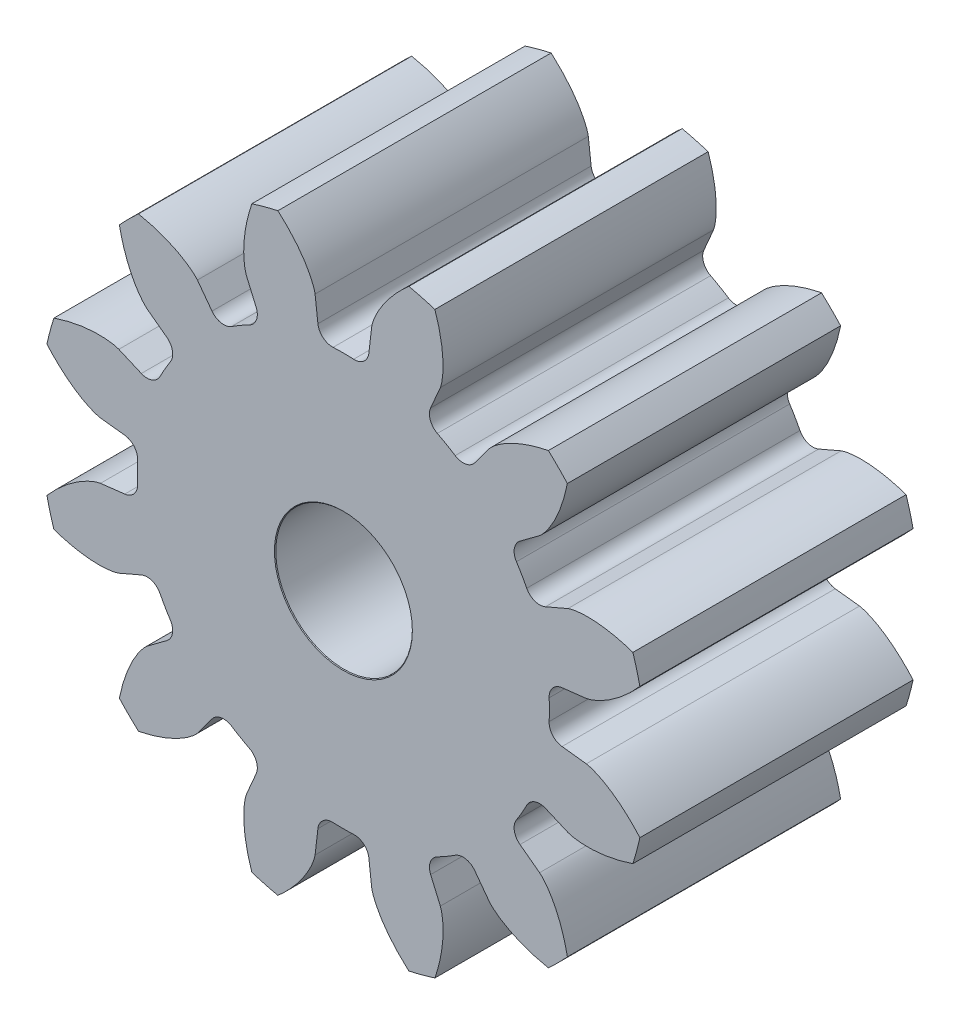
from build123d import *

# Parameters (mm, degrees)
BOSS_EXTRUDE1_DEPTH             = 5
BOSS_EXTRUDE1_DEPTH_BACK        = 5
SKETCH3_R                       = 11.1125
CUT_EXTRUDE1_DEPTH              = 17.491674036
FILLET1_R                       = 0.532614244
CIRPATTERN1_COUNT               = 12
FILLET1_OF_CIRPATTERN1_R        = 0.532614244
F_5_0MM_DOWEL_HOLE1_D           = 5
F_5_0MM_DOWEL_HOLE1_CSINK_D     = 5.05
F_5_0MM_DOWEL_HOLE1_CSINK_ANGLE = 90


with BuildPart() as part:
    # Sketch3 → Boss-Extrude1 (new, two sides: drawn at the far end of the back side and taken through both)
    with BuildSketch(Plane.XY.offset(-BOSS_EXTRUDE1_DEPTH_BACK)):
        Circle(SKETCH3_R)
    extrude(amount=BOSS_EXTRUDE1_DEPTH + BOSS_EXTRUDE1_DEPTH_BACK)

    # Sketch4 → Cut-Extrude1 (cut, symmetric)
    with BuildSketch(Plane.XY):
        with BuildLine():
            Line((7.489952632, 0.872717003), (8.890425117, 1.035897762))
            add(Edge.make_bspline(
                [(8.890425117, 1.035897762), (8.893977287, 1.036367808), (8.903916971, 1.037857339), (8.92261193, 1.041348665), (8.952952171, 1.04800026), (8.991346271, 1.057874085), (9.040627447, 1.072233523), (9.098201681, 1.091193619), (9.160923496, 1.114158975), (9.22851878, 1.141425686), (9.295348144, 1.170633163), (9.361413742, 1.201621663), (9.426661512, 1.23415387), (9.504993746, 1.27550925), (9.597919154, 1.327797939), (9.704976774, 1.392800595), (9.824483071, 1.471074042), (9.944101463, 1.555636811), (10.059971887, 1.642759182), (10.174809704, 1.73520032), (10.284329083, 1.827766991), (10.395649082, 1.928332274), (10.497173697, 2.023416013), (10.608084989, 2.134725273), (10.696775398, 2.225959376), (10.785941859, 2.324115328), (10.828973943, 2.37246167), (10.850810267, 2.397409603)],
                knots=[0, 0, 0, 0, 0, 0.005376749, 0.015083688, 0.02853182, 0.046610139, 0.064854849, 0.092110525, 0.119476176, 0.146842496, 0.174208854, 0.201574956, 0.228941013, 0.256307345, 0.307035032, 0.361767352, 0.416499661, 0.471231937, 0.525964282, 0.580696615, 0.635428982, 0.690161387, 0.744893688, 0.799626082, 0.854358408, 0.909090915, 0.909090915, 0.909090915, 0.909090915, 0.909090915], degree=4))
            ThreePointArc((10.850810267, 2.397409603), (11.1125, 0), (10.850810267, -2.397409603))
            add(Edge.make_bspline(
                [(8.890425117, -1.035897762), (8.893977287, -1.036367808), (8.903916971, -1.037857339), (8.92261193, -1.041348665), (8.952952171, -1.04800026), (8.991346271, -1.057874085), (9.040627447, -1.072233523), (9.098201681, -1.091193619), (9.160923496, -1.114158975), (9.22851878, -1.141425686), (9.295348144, -1.170633163), (9.361413742, -1.201621663), (9.426661512, -1.23415387), (9.504993746, -1.27550925), (9.597919154, -1.327797939), (9.704976774, -1.392800595), (9.824483071, -1.471074042), (9.944101463, -1.555636811), (10.059971887, -1.642759182), (10.174809704, -1.73520032), (10.284329083, -1.827766991), (10.395649082, -1.928332274), (10.497173697, -2.023416013), (10.608084989, -2.134725273), (10.696775398, -2.225959376), (10.785941859, -2.324115328), (10.828973943, -2.37246167), (10.850810267, -2.397409603)],
                knots=[0, 0, 0, 0, 0, 0.005376749, 0.015083688, 0.02853182, 0.046610139, 0.064854849, 0.092110525, 0.119476176, 0.146842496, 0.174208854, 0.201574956, 0.228941013, 0.256307345, 0.307035032, 0.361767352, 0.416499661, 0.471231937, 0.525964282, 0.580696615, 0.635428982, 0.690161387, 0.744893688, 0.799626082, 0.854358408, 0.909090915, 0.909090915, 0.909090915, 0.909090915, 0.909090915], degree=4))
            Line((8.890425117, -1.035897762), (7.489952632, -0.872717003))
            ThreePointArc((7.489952632, -0.872717003), (7.540625, 0), (7.489952632, 0.872717003))
        make_face()
    cut_extrude1 = extrude(amount=CUT_EXTRUDE1_DEPTH, both=True, mode=Mode.SUBTRACT)

    # Fillet1
    fillet1_edges = [part.edges().sort_by_distance(p)[0] for p in [
        (7.489952632, -0.872717003, 0),
        (7.489952632, 0.872717003, 0),
    ]]
    fillet(fillet1_edges, radius=FILLET1_R)

    # CirPattern1: Cut-Extrude1 ×12 about axis
    cirpattern1_axis = Axis((0, 0, 5.000000033), (0, 0, -1))
    for i in range(1, CIRPATTERN1_COUNT):
        add(cut_extrude1.rotate(cirpattern1_axis, i * 360 / CIRPATTERN1_COUNT), mode=Mode.SUBTRACT)

    # Fillet1 of CirPattern1
    fillet1_of_cirpattern1_edges = [part.edges().sort_by_distance(p)[0] for p in [
        (6.05013075, -4.500771411, 0),
        (6.922847754, -2.989181221, 0),
        (2.989181221, -6.922847754, 0),
        (4.500771411, -6.05013075, 0),
        (-0.872717003, -7.489952632, 0),
        (0.872717003, -7.489952632, 0),
        (-4.500771411, -6.05013075, 0),
        (-2.989181221, -6.922847754, 0),
        (-6.922847754, -2.989181221, 0),
        (-6.05013075, -4.500771411, 0),
        (-7.489952632, 0.872717003, 0),
        (-7.489952632, -0.872717003, 0),
        (-6.05013075, 4.500771411, 0),
        (-6.922847754, 2.989181221, 0),
        (-2.989181221, 6.922847754, 0),
        (-4.500771411, 6.05013075, 0),
        (0.872717003, 7.489952632, 0),
        (-0.872717003, 7.489952632, 0),
        (4.500771411, 6.05013075, 0),
        (2.989181221, 6.922847754, 0),
        (6.922847754, 2.989181221, 0),
        (6.05013075, 4.500771411, 0),
    ]]
    fillet(fillet1_of_cirpattern1_edges, radius=FILLET1_OF_CIRPATTERN1_R)

    # Ø5.0mm Dowel Hole1 (through all)
    with Locations(Plane.XY.offset(5.000000033)):
        with Locations((0, 0)):
            CounterSinkHole(F_5_0MM_DOWEL_HOLE1_D / 2, F_5_0MM_DOWEL_HOLE1_CSINK_D / 2, counter_sink_angle=F_5_0MM_DOWEL_HOLE1_CSINK_ANGLE)


solid = part.part
